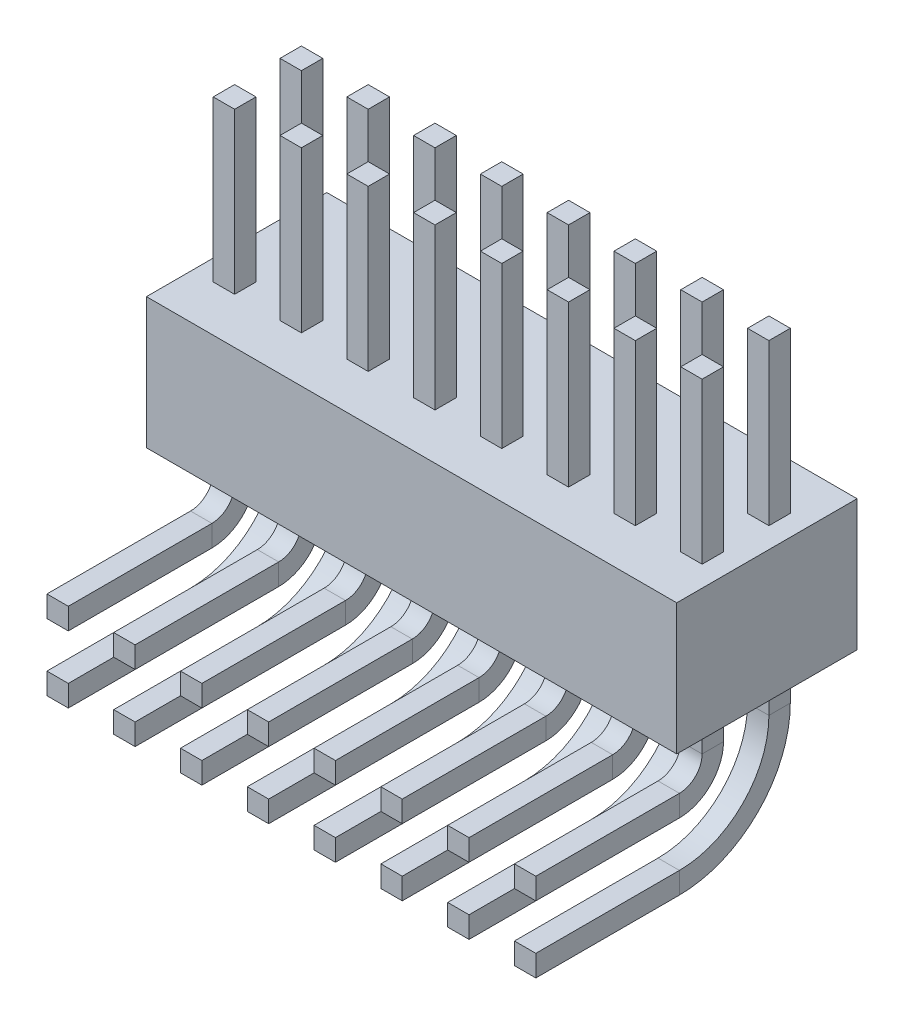
from build123d import *

# Parameters (mm, degrees)
SKETCH1_W           = 10.0838
SKETCH1_H           = 3.429
BOSS_EXTRUDE1_DEPTH = 1.2446
SKETCH3_W           = 0.4064
SKETCH3_H           = 0.4064
LPATTERN1_COUNT     = 8
LPATTERN1_PITCH     = 1.27


with BuildPart() as part:
    # Sketch1 → Boss-Extrude1 (new, symmetric)
    with BuildSketch(Plane(origin=(0, 0, 0), x_dir=(1, 0, 0), z_dir=(0, 1, 0))):
        Rectangle(SKETCH1_W, SKETCH1_H)
    extrude(amount=BOSS_EXTRUDE1_DEPTH, both=True)

    # Sweep1: sweep along a path in Sketch2
    with BuildLine(Plane(origin=(4.445, 0, 0), x_dir=(0, 0, -1), z_dir=(1, 0, 0))) as sweep1_path:
        Line((-0.635, 4.2926), (-0.635, -1.8796))
        ThreePointArc((-0.635, -1.8796), (-0.820987194, -2.328612806), (-1.27, -2.5146))
        Line((-1.27, -2.5146), (-4.0005, -2.5146))
    # Sketch3 → Sweep1 (sweep)
    with BuildSketch(Plane(origin=(0, 4.2926, 0), x_dir=(1, 0, 0), z_dir=(0, 1, 0))):
        with Locations((4.445, -0.635)):
            Rectangle(SKETCH3_W, SKETCH3_H)
        with Locations((4.445, 0.635)):
            Rectangle(SKETCH3_W, SKETCH3_H)
    sweep1 = sweep(path=sweep1_path.line)

    # LPattern1: Sweep1 ×8
    with Locations(*[(-i * LPATTERN1_PITCH, 0, 0) for i in range(1, LPATTERN1_COUNT)]):
        add(sweep1)


solid = part.part
